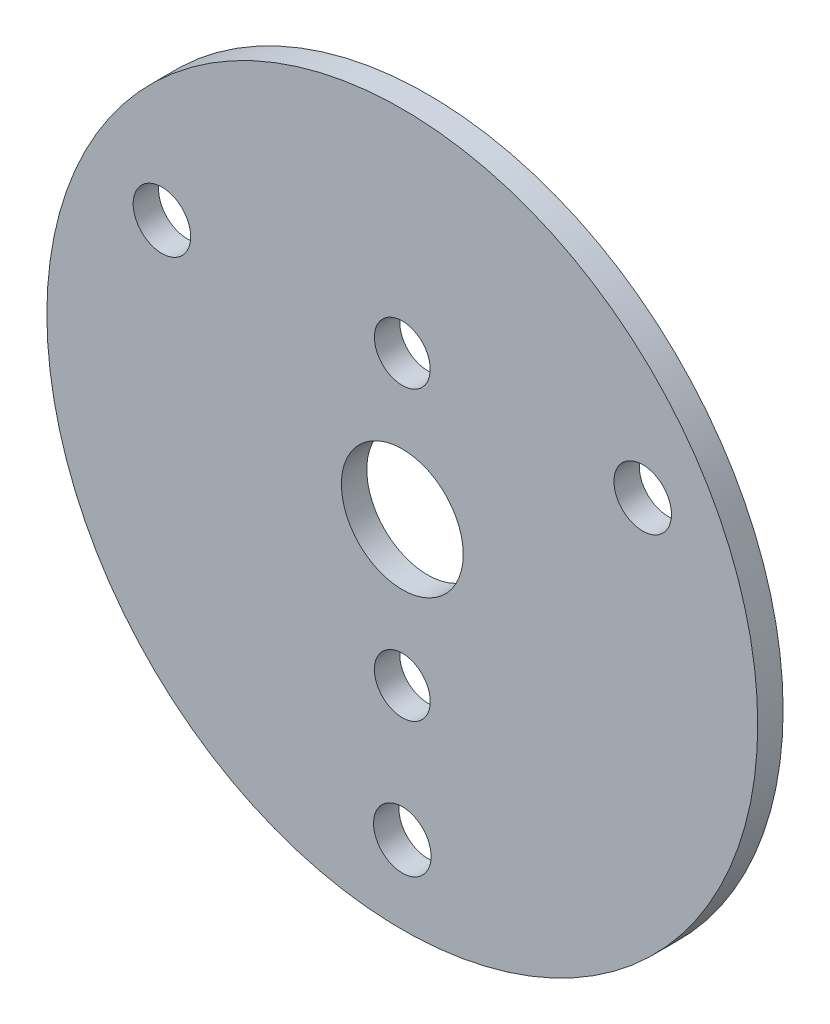
from build123d import *

# Parameters (mm, degrees)
S01_FLAT_1_5_MM_STEEL_DISC_AND_GEARBOX_R       = 21
S01_FLAT_1_5_MM_STEEL_DISC_AND_GEARBOX_R_2     = 3.6
F_01_FLAT_1_5_MM_STEEL_DISC_AND_GEARBOX_DEPTH  = 1.5
F_02_START                                     = -0.1
S02_THREE_CARRIER_BOLTS_R                      = 1.7
F_02_THREE_CARRIER_BOLTS_DEPTH                 = 1.7
F_03_START                                     = -0.1
S03_TWO_POLOLU_FACE_SCREWS_AT_17_MM_PI_R       = 1.65
F_03_TWO_POLOLU_FACE_SCREWS_AT_17_MM_PIT_DEPTH = 1.7


with BuildPart() as part:
    # S01 - Flat 1.5 mm steel disc and gearbox pilot → 01 - Flat 1.5 mm steel disc and gearbox pilot (new body)
    with BuildSketch(Plane.XY):
        Circle(S01_FLAT_1_5_MM_STEEL_DISC_AND_GEARBOX_R)
        Circle(S01_FLAT_1_5_MM_STEEL_DISC_AND_GEARBOX_R_2, mode=Mode.SUBTRACT)
    extrude(amount=F_01_FLAT_1_5_MM_STEEL_DISC_AND_GEARBOX_DEPTH)

    # S02 - Three carrier bolts → 02 - Three carrier bolts (cut)
    with BuildSketch(Plane.XY.offset(F_02_START)):
        with Locations((14.202816622, 8.2)):
            Circle(S02_THREE_CARRIER_BOLTS_R)
        with Locations((-14.202816622, 8.2)):
            Circle(S02_THREE_CARRIER_BOLTS_R)
        with Locations((0, -16.4)):
            Circle(S02_THREE_CARRIER_BOLTS_R)
    extrude(amount=F_02_THREE_CARRIER_BOLTS_DEPTH, mode=Mode.SUBTRACT)

    # S03 - Two Pololu face screws at 17 mm pitch → 03 - Two Pololu face screws at 17 mm pitch (cut)
    with BuildSketch(Plane.XY.offset(F_03_START)):
        with Locations((0, 8.5)):
            Circle(S03_TWO_POLOLU_FACE_SCREWS_AT_17_MM_PI_R)
        with Locations((0, -8.5)):
            Circle(S03_TWO_POLOLU_FACE_SCREWS_AT_17_MM_PI_R)
    extrude(amount=F_03_TWO_POLOLU_FACE_SCREWS_AT_17_MM_PIT_DEPTH, mode=Mode.SUBTRACT)


solid = part.part
